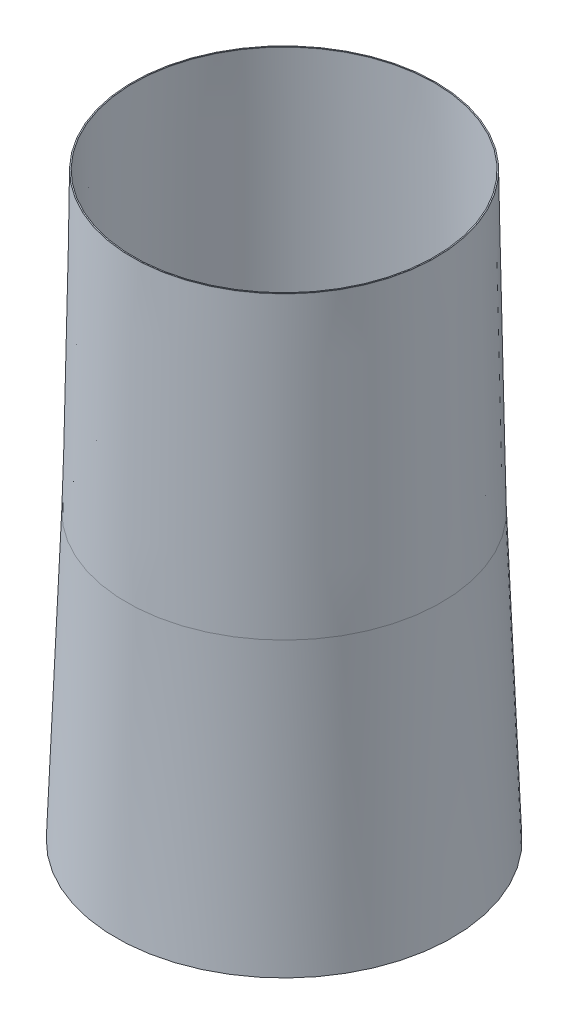
from build123d import *


with BuildPart() as part:
    # Skica1 → Rotovat1 (revolve)
    with BuildSketch(Plane.XY, mode=Mode.PRIVATE) as rotovat1_sk:
        with BuildLine():
            Line((-14.349982858, 244.001851534), (-13.849982858, 271.001851534))
            ThreePointArc((-13.849982858, 271.001851534), (-13.849828576, 271.018515344), (-13.849982858, 271.035179154))
            Line((-13.849982858, 271.035179154), (-13.75, 271.037030688))
            ThreePointArc((-13.75, 271.037030688), (-13.749828576, 271.018515344), (-13.75, 271))
            Line((-13.75, 271), (-14.25, 244))
            ThreePointArc((-14.25, 244), (-14.620475493, 230.995018288), (-15.25, 218))
            Line((-15.25, 218), (-15.349829703, 218.005833564))
            ThreePointArc((-15.349829703, 218.005833564), (-14.72040161, 230.9988616), (-14.349982858, 244.001851534))
        make_face()
    revolve(rotovat1_sk.sketch.rotate(Axis((0, 0, 0), (0, 1, 0)), 270), axis=Axis((0, 0, 0), (0, 1, 0)))


solid = part.part
